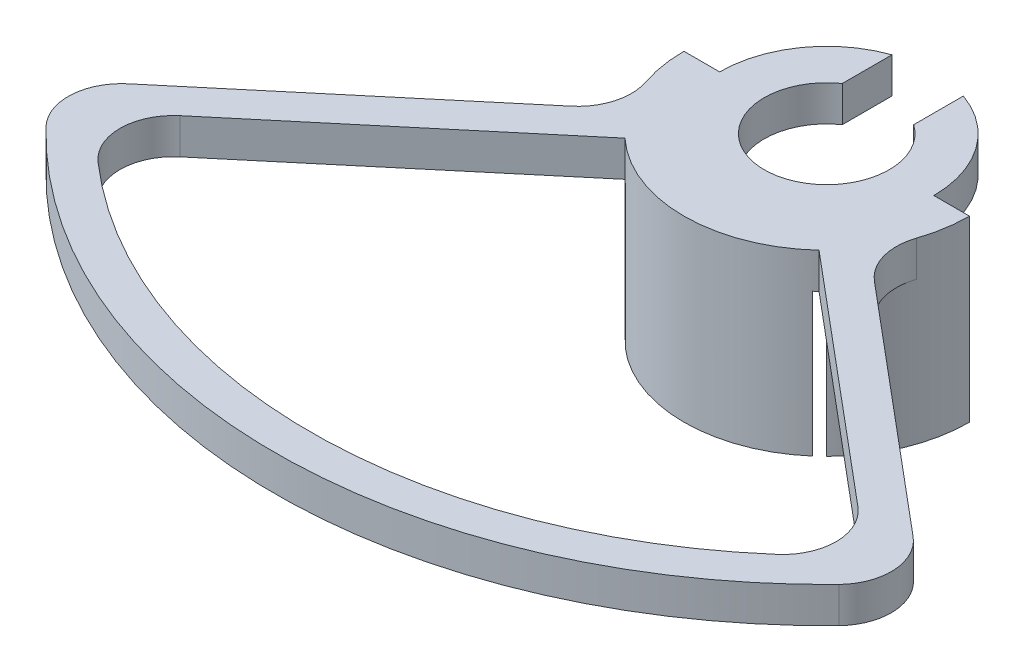
from build123d import *

# Parameters (mm, degrees)
BOSS_EXTRUDE1_DEPTH             = 2
BOSS_EXTRUDE2_DEPTH             = 8
BOSS_EXTRUDE2_DIRECTION_2_REACH = 41.402
BOSS_EXTRUDE3_START             = 2
BOSS_EXTRUDE3_DEPTH             = 2
FILLET1_R                       = 3


with BuildPart() as part:
    # Sketch1 → Boss-Extrude1 (new body)
    with BuildSketch(Plane(origin=(0, 0, 0), x_dir=(1, 0, 0), z_dir=(0, 1, 0))):
        with BuildLine():
            Line((-2, 2.872281323), (-2, 5.656854249))
            ThreePointArc((-2, 5.656854249), (-3.622947325, 4.782703491), (-4.903918858, 3.457105702))
            ThreePointArc((-4.903918858, 3.457105702), (-5.994787991, 0.250033892), (-5.174767653, -3.036738339))
            Line((-5.174767653, -3.036738339), (-24.325878731, -19.106428582))
            ThreePointArc((-24.325878731, -19.106428582), (0, -30.932248369), (24.325878731, -19.106428582))
            Line((24.325878731, -19.106428582), (5.174767653, -3.036738339))
            ThreePointArc((5.174767653, -3.036738339), (5.869268357, 1.245668074), (3.495228191, 4.876820675))
            ThreePointArc((3.495228191, 4.876820675), (2.775156989, 5.319633793), (2, 5.656854249))
            Line((2, 5.656854249), (2, 2.872281323))
            ThreePointArc((2, 2.872281323), (0, -3.5), (-2, 2.872281323))
        make_face()
        with BuildLine():
            Line((21.508214625, -19.352942248), (3.889192433, -4.568827226))
            ThreePointArc((3.889192433, -4.568827226), (1.593935567, -5.784407438), (-1, -5.916079783))
            ThreePointArc((-1, -5.916079783), (-2.53570957, -5.437846722), (-3.889192433, -4.568827226))
            Line((-3.889192433, -4.568827226), (-21.508214625, -19.352942248))
            ThreePointArc((-21.508214625, -19.352942248), (0, -28.933366033), (21.508214625, -19.352942248))
        make_face(mode=Mode.SUBTRACT)
    extrude(amount=BOSS_EXTRUDE1_DEPTH)

    # Sketch2 → Boss-Extrude2 (add)
    with BuildSketch(Plane(origin=(0, 0, 0), x_dir=(1, 0, 0), z_dir=(0, 1, 0))):
        with BuildLine():
            Line((-8, 0), (-5.9, 0))
            ThreePointArc((-5.9, 0), (-5.482722017, -2.179394246), (-4.289912109, -4.050512819))
            Line((-4.289912109, -4.050512819), (-5.653884688, -5.659822253))
            ThreePointArc((-5.653884688, -5.659822253), (-7.390232659, -3.063406804), (-8, 0))
        make_face()
        with BuildLine():
            Line((8, 0), (5.9, 0))
            ThreePointArc((5.9, 0), (5.482722017, -2.179394246), (4.289912109, -4.050512819))
            Line((4.289912109, -4.050512819), (5.653884688, -5.659822253))
            ThreePointArc((5.653884688, -5.659822253), (7.390232659, -3.063406804), (8, 0))
        make_face()
        with BuildLine():
            Line((3.741396832, -4.562011589), (5.251640152, -6.034921351))
            ThreePointArc((5.251640152, -6.034921351), (0, -8), (-5.251640152, -6.034921351))
            Line((-5.251640152, -6.034921351), (-3.741396832, -4.562011589))
            ThreePointArc((-3.741396832, -4.562011589), (0, -5.9), (3.741396832, -4.562011589))
        make_face()
    extrude(amount=-BOSS_EXTRUDE2_DEPTH)

    # Boss-Extrude2 direction 2: up to this face of the body (flat: up to its plane)
    boss_extrude2_direction_2_end = Plane(part.part.faces().sort_by_distance((14.359026746, 2, 11.537912405))[0])
    # Sketch2 → Boss-Extrude2 direction 2 (add, up to the picked face)
    with BuildSketch(Plane(origin=(0, 0, 0), x_dir=(1, 0, 0), z_dir=(0, 1, 0)), mode=Mode.PRIVATE) as boss_extrude2_direction_2_sk1:
        with BuildLine():
            Line((-8, 0), (-5.9, 0))
            ThreePointArc((-5.9, 0), (-5.482722017, -2.179394246), (-4.289912109, -4.050512819))
            Line((-4.289912109, -4.050512819), (-5.653884688, -5.659822253))
            ThreePointArc((-5.653884688, -5.659822253), (-7.390232659, -3.063406804), (-8, 0))
        make_face()
    boss_extrude2_direction_2_tool1 = split(extrude(boss_extrude2_direction_2_sk1.sketch, amount=BOSS_EXTRUDE2_DIRECTION_2_REACH, mode=Mode.PRIVATE), bisect_by=boss_extrude2_direction_2_end, keep=Keep.BOTH, mode=Mode.PRIVATE)
    # Sketch2 → Boss-Extrude2 direction 2 (add, up to the picked face)
    with BuildSketch(Plane(origin=(0, 0, 0), x_dir=(1, 0, 0), z_dir=(0, 1, 0)), mode=Mode.PRIVATE) as boss_extrude2_direction_2_sk2:
        with BuildLine():
            Line((8, 0), (5.9, 0))
            ThreePointArc((5.9, 0), (5.482722017, -2.179394246), (4.289912109, -4.050512819))
            Line((4.289912109, -4.050512819), (5.653884688, -5.659822253))
            ThreePointArc((5.653884688, -5.659822253), (7.390232659, -3.063406804), (8, 0))
        make_face()
    boss_extrude2_direction_2_tool2 = split(extrude(boss_extrude2_direction_2_sk2.sketch, amount=BOSS_EXTRUDE2_DIRECTION_2_REACH, mode=Mode.PRIVATE), bisect_by=boss_extrude2_direction_2_end, keep=Keep.BOTH, mode=Mode.PRIVATE)
    # Sketch2 → Boss-Extrude2 direction 2 (add, up to the picked face)
    with BuildSketch(Plane(origin=(0, 0, 0), x_dir=(1, 0, 0), z_dir=(0, 1, 0)), mode=Mode.PRIVATE) as boss_extrude2_direction_2_sk3:
        with BuildLine():
            Line((3.741396832, -4.562011589), (5.251640152, -6.034921351))
            ThreePointArc((5.251640152, -6.034921351), (0, -8), (-5.251640152, -6.034921351))
            Line((-5.251640152, -6.034921351), (-3.741396832, -4.562011589))
            ThreePointArc((-3.741396832, -4.562011589), (0, -5.9), (3.741396832, -4.562011589))
        make_face()
    boss_extrude2_direction_2_tool3 = split(extrude(boss_extrude2_direction_2_sk3.sketch, amount=BOSS_EXTRUDE2_DIRECTION_2_REACH, mode=Mode.PRIVATE), bisect_by=boss_extrude2_direction_2_end, keep=Keep.BOTH, mode=Mode.PRIVATE)
    add(boss_extrude2_direction_2_tool1.solids().sort_by(Axis((-6.329529, 0, 2.580804), (0, 1, 0)))[0])
    add(boss_extrude2_direction_2_tool2.solids().sort_by(Axis((6.329529, 0, 2.580804), (0, 1, 0)))[0])
    add(boss_extrude2_direction_2_tool3.solids().sort_by(Axis((0, 0, 6.444232), (0, 1, 0)))[0])

    # Sketch3 → Boss-Extrude3 (add)
    with BuildSketch(Plane(origin=(0, 0, 0), x_dir=(1, 0, 0), z_dir=(0, 1, 0)).offset(BOSS_EXTRUDE3_START)):
        with BuildLine():
            Line((-8, 0), (-5.903175189, 0))
            ThreePointArc((-5.903175189, 0), (0, -5.903175189), (5.903175189, 0))
            Line((5.903175189, 0), (8, 0))
            ThreePointArc((8, 0), (0, -8), (-8, 0))
        make_face()
    extrude(amount=-BOSS_EXTRUDE3_DEPTH)

    # Fillet1
    fillet1_edges = [part.edges().sort_by_distance(p)[0] for p in [
        (24.325878731, 1, 19.106428582),
        (-24.325878731, 1, 19.106428582),
        (-21.508214625, 1, 19.352942248),
        (21.508214625, 1, 19.352942248),
        (-6.723076879, 1, 4.33592404),
        (6.723076879, 1, 4.33592404),
    ]]
    fillet(fillet1_edges, radius=FILLET1_R)


solid = part.part
